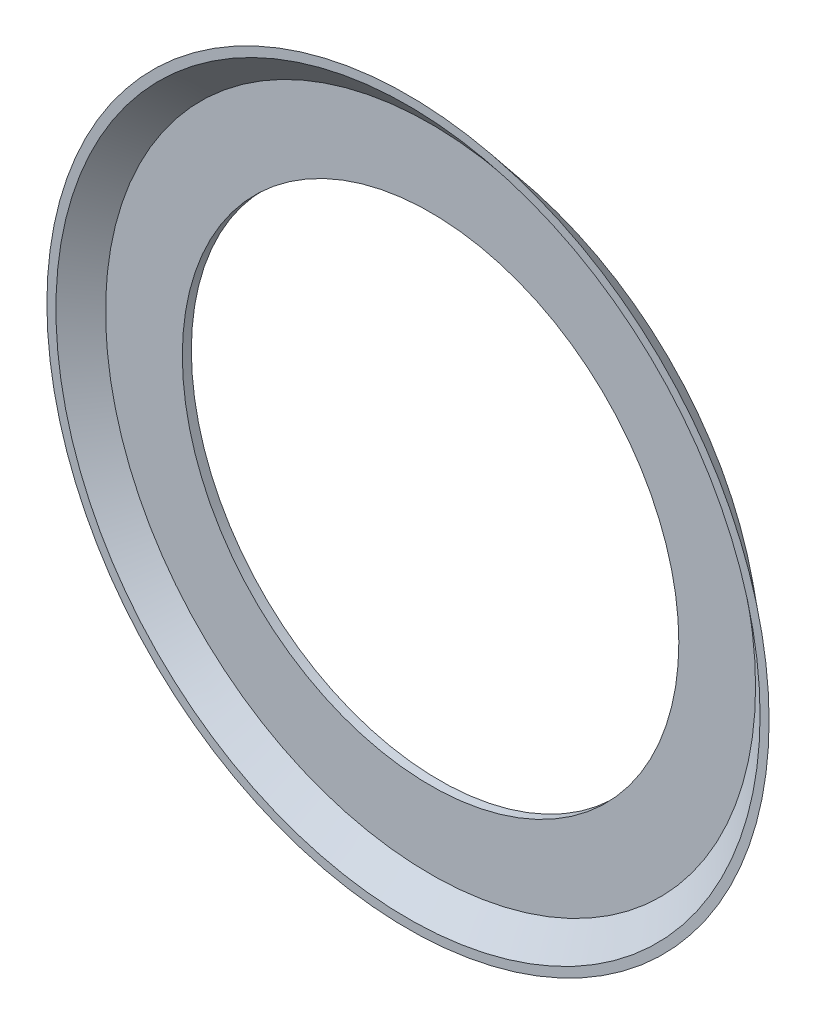
from build123d import *


with BuildPart() as part:
    # Sketch1 → Revolve1 (revolve)
    with BuildSketch(Plane(origin=(0, 0, 0), x_dir=(0, 0, -1), z_dir=(1, 0, 0)), mode=Mode.PRIVATE) as revolve1_sk:
        Polygon((-5, 78), (0, 72), (0, 55), (2, 55), (2, 69.6), (5, 66), (5, 68), (-5, 80), align=None)
    revolve(revolve1_sk.sketch.rotate(Axis((0, 0, 19.562969898), (0, 0, -1)), 90), axis=Axis((0, 0, 19.562969898), (0, 0, -1)))


solid = part.part
